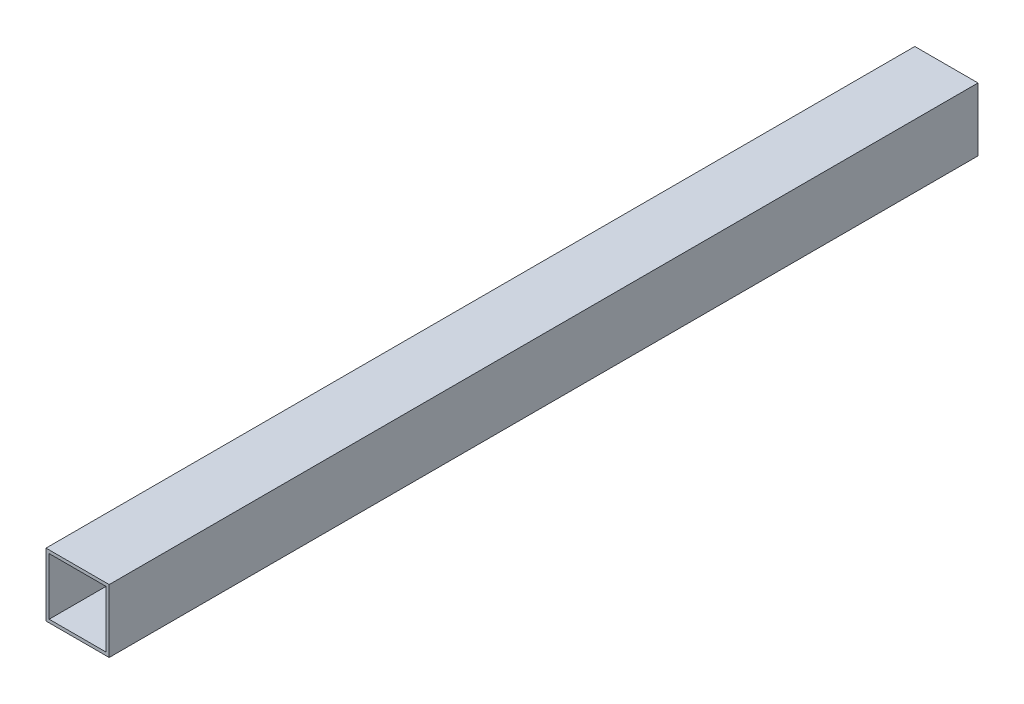
from build123d import *

# Parameters (mm, degrees)
SKETCH1_W           = 40
SKETCH1_H           = 40
SKETCH1_W_2         = 36
SKETCH1_H_2         = 36
BOSS_EXTRUDE1_DEPTH = 550


with BuildPart() as part:
    # Sketch1 → Boss-Extrude1 (new body)
    with BuildSketch(Plane.XY):
        with Locations((-945, 1611.5)):
            Rectangle(SKETCH1_W, SKETCH1_H)
        with Locations((-945, 1611.5)):
            Rectangle(SKETCH1_W_2, SKETCH1_H_2, mode=Mode.SUBTRACT)
    extrude(amount=BOSS_EXTRUDE1_DEPTH)


solid = part.part
